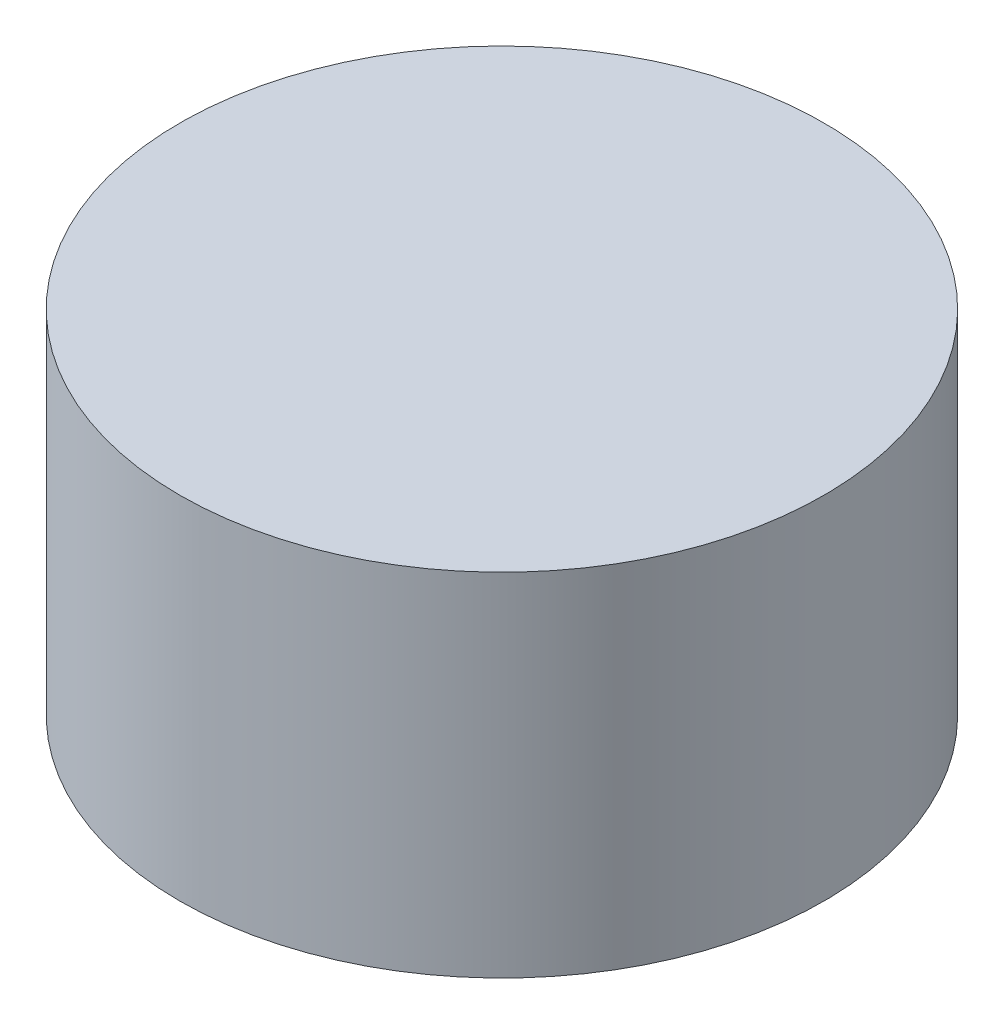
from build123d import *

# Parameters (mm, degrees)
SKETCH1_R           = 73.35
BOSS_EXTRUDE1_DEPTH = 40


with BuildPart() as part:
    # Sketch1 → Boss-Extrude1 (new, symmetric)
    with BuildSketch(Plane(origin=(0, 0, 0), x_dir=(1, 0, 0), z_dir=(0, 1, 0))):
        with Locations(Location((0, 0, 0), (0, 0, 270))):
            Circle(SKETCH1_R)
    extrude(amount=BOSS_EXTRUDE1_DEPTH, both=True)


solid = part.part
